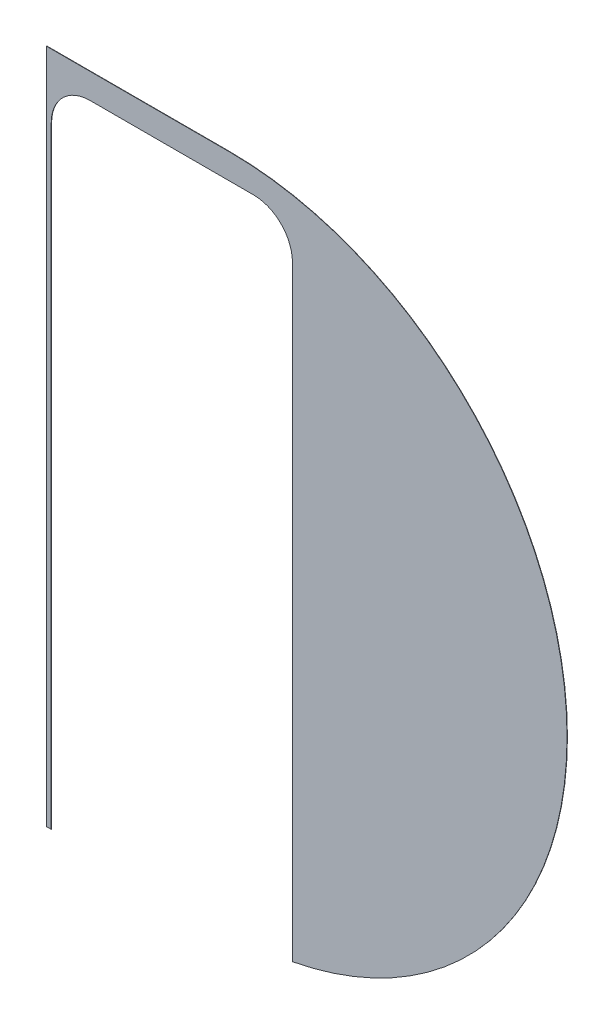
from build123d import *

# Parameters (mm, degrees)
BOSS_EXTRUDE1_DEPTH = 1
CUT_EXTRUDE2_DEPTH  = 330


with BuildPart() as part:
    # Sketch1 → Boss-Extrude1 (new body)
    with BuildSketch(Plane.XY):
        with BuildLine():
            Line((0, 0), (470, 0))
            ThreePointArc((470, 0), (1340, 870), (470, 1740))
            Line((470, 1740), (0, 1740))
            Line((0, 1740), (0, 0))
        make_face()
    extrude(amount=BOSS_EXTRUDE1_DEPTH)

    # Sketch3 → Cut-Extrude2 (cut)
    with BuildSketch(Plane(origin=(-1354.112118138, -994.457487155, -32), x_dir=(-1, 0, 0), z_dir=(0, 0, -1))):
        with BuildLine():
            Line((-1887.112118138, 819.457487155), (-1466.112118138, 819.457487155))
            ThreePointArc((-1466.112118138, 819.457487155), (-1395.40144002, 848.746809036), (-1366.112118138, 919.457487155))
            Line((-1366.112118138, 919.457487155), (-1366.112118138, 2569.457487155))
            ThreePointArc((-1366.112118138, 2569.457487155), (-1395.40144002, 2640.168165273), (-1466.112118138, 2669.457487155))
            Line((-1466.112118138, 2669.457487155), (-1887.112118138, 2669.457487155))
            ThreePointArc((-1887.112118138, 2669.457487155), (-1957.822796257, 2640.168165273), (-1987.112118138, 2569.457487155))
            Line((-1987.112118138, 2569.457487155), (-1987.112118138, 919.457487155))
            ThreePointArc((-1987.112118138, 919.457487155), (-1957.822796257, 848.746809036), (-1887.112118138, 819.457487155))
        make_face()
    extrude(amount=-CUT_EXTRUDE2_DEPTH, mode=Mode.SUBTRACT)


solid = part.part
